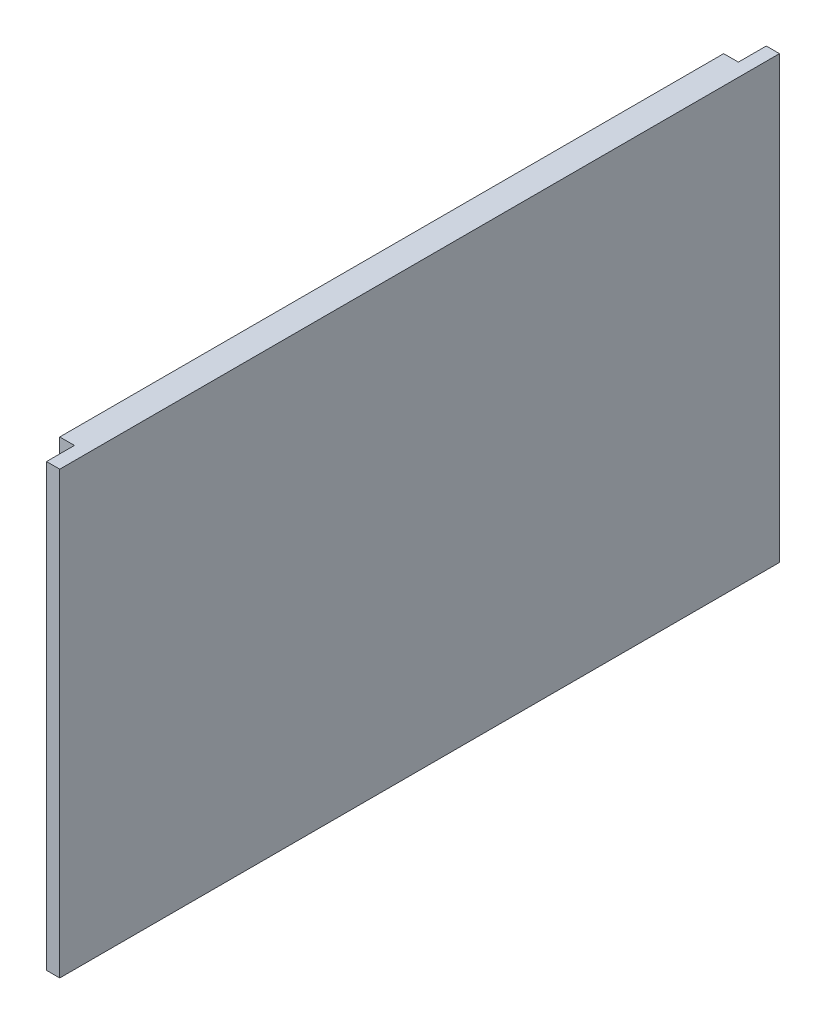
from build123d import *

# Parameters (mm, degrees)
SKETCH1_W           = 490
SKETCH1_H           = 300
BOSS_EXTRUDE1_DEPTH = 19
SKETCH5_W           = 10
SKETCH5_H           = 300
CUT_EXTRUDE1_DEPTH  = 19
SKETCH6_W           = 19
SKETCH6_H           = 300
CUT_EXTRUDE3_DEPTH  = 10


with BuildPart() as part:
    # Sketch1 → Boss-Extrude1 (new body)
    with BuildSketch(Plane(origin=(0, 0, 0), x_dir=(0, 0, -1), z_dir=(1, 0, 0))):
        with Locations((245, 150)):
            Rectangle(SKETCH1_W, SKETCH1_H)
    extrude(amount=BOSS_EXTRUDE1_DEPTH)

    # Sketch5 → Cut-Extrude1 (cut)
    with BuildSketch(Plane.XY):
        with Locations((5, 150)):
            Rectangle(SKETCH5_W, SKETCH5_H)
    extrude(amount=-CUT_EXTRUDE1_DEPTH, mode=Mode.SUBTRACT)

    # Sketch6 → Cut-Extrude3 (cut)
    with BuildSketch(Plane.ZY):
        with Locations((-480.5, 150)):
            Rectangle(SKETCH6_W, SKETCH6_H)
    extrude(amount=-CUT_EXTRUDE3_DEPTH, mode=Mode.SUBTRACT)


solid = part.part
